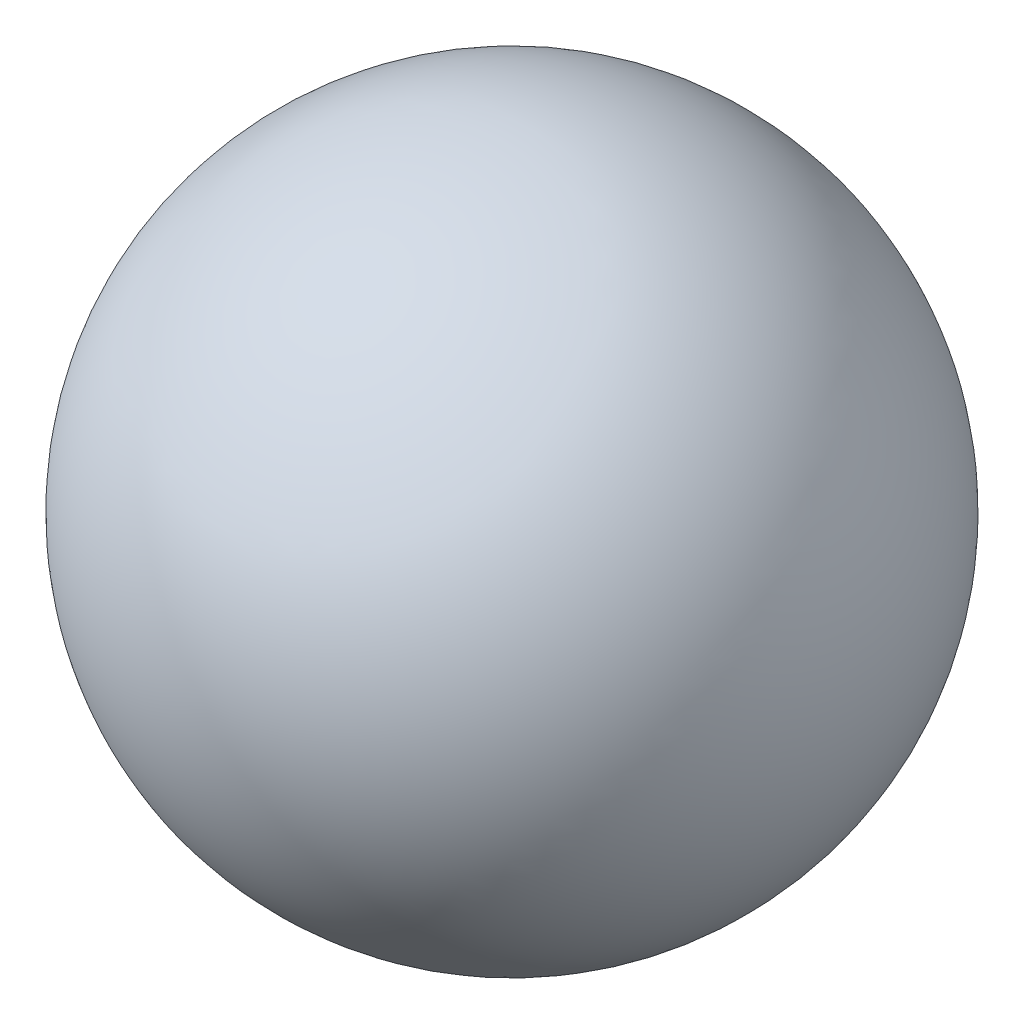
from build123d import *


with BuildPart() as part:
    # Sketch1 → Revolve1 (revolve)
    with BuildSketch(Plane(origin=(0, 0, 0), x_dir=(1, 0, 0), z_dir=(0, 1, 0))):
        with BuildLine():
            Line((0, 127), (0, -127))
            ThreePointArc((0, -127), (127, 0), (0, 127))
        make_face()
    revolve(axis=Axis((0, 0, -127), (0, 0, 1)))


solid = part.part
